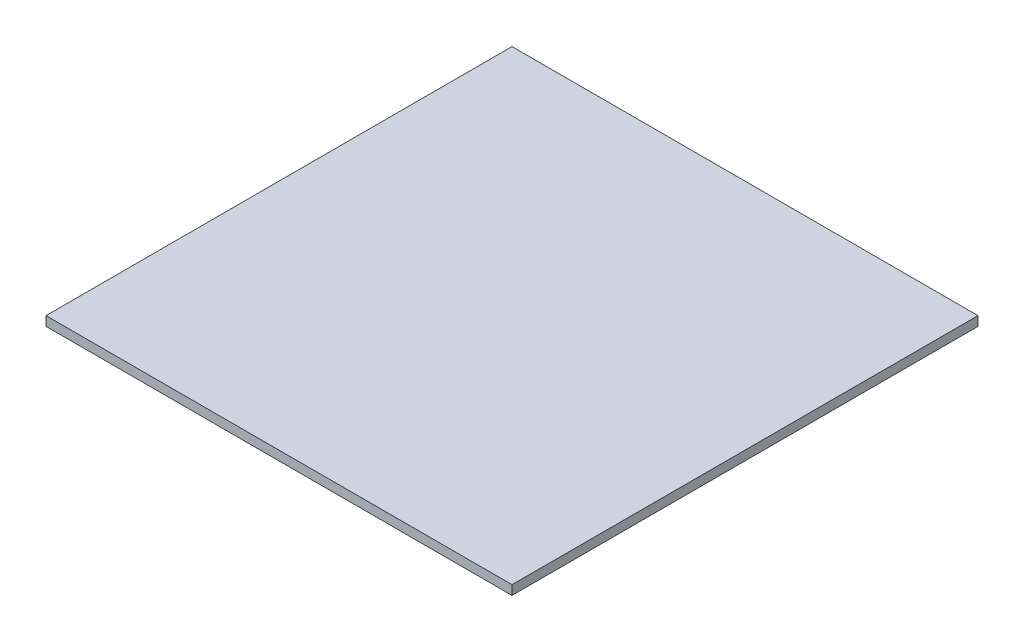
from build123d import *

# Parameters (mm, degrees)
SKETCH1_W           = 500
SKETCH1_H           = 500
BOSS_EXTRUDE1_DEPTH = 10
SKETCH2_W           = 100
SKETCH2_H           = 200
BOSS_EXTRUDE2_DEPTH = 50
CUT_EXTRUDE1_REACH  = 435.013
SKETCH3_W           = 41
SKETCH3_H           = 22


with BuildPart() as part:
    # Sketch1 → Boss-Extrude1 (new body)
    with BuildSketch(Plane(origin=(0, 0, 0), x_dir=(1, 0, 0), z_dir=(0, 1, 0))):
        Rectangle(SKETCH1_W, SKETCH1_H)
    extrude(amount=BOSS_EXTRUDE1_DEPTH)

    # Sketch2 → Boss-Extrude2 (add)
    with BuildSketch(Plane.XZ):
        Rectangle(SKETCH2_W, SKETCH2_H)
    extrude(amount=BOSS_EXTRUDE2_DEPTH)

    # Sketch3 → Cut-Extrude1 (cut, up to next)
    with BuildSketch(Plane.XY.offset(100), mode=Mode.PRIVATE) as cut_extrude1_sk1:
        with Locations((-25, -25)):
            Rectangle(SKETCH3_W, SKETCH3_H)
    cut_extrude1_tool1 = extrude(cut_extrude1_sk1.sketch, amount=-CUT_EXTRUDE1_REACH, mode=Mode.PRIVATE) & part.part
    # Sketch3 → Cut-Extrude1 (cut, up to next)
    with BuildSketch(Plane.XY.offset(100), mode=Mode.PRIVATE) as cut_extrude1_sk2:
        with Locations((25, -25)):
            Rectangle(SKETCH3_W, SKETCH3_H)
    cut_extrude1_tool2 = extrude(cut_extrude1_sk2.sketch, amount=-CUT_EXTRUDE1_REACH, mode=Mode.PRIVATE) & part.part
    add(cut_extrude1_tool1.solids().sort_by_distance((-25, -25, 100))[0], mode=Mode.SUBTRACT)
    add(cut_extrude1_tool2.solids().sort_by_distance((25, -25, 100))[0], mode=Mode.SUBTRACT)


solid = part.part
